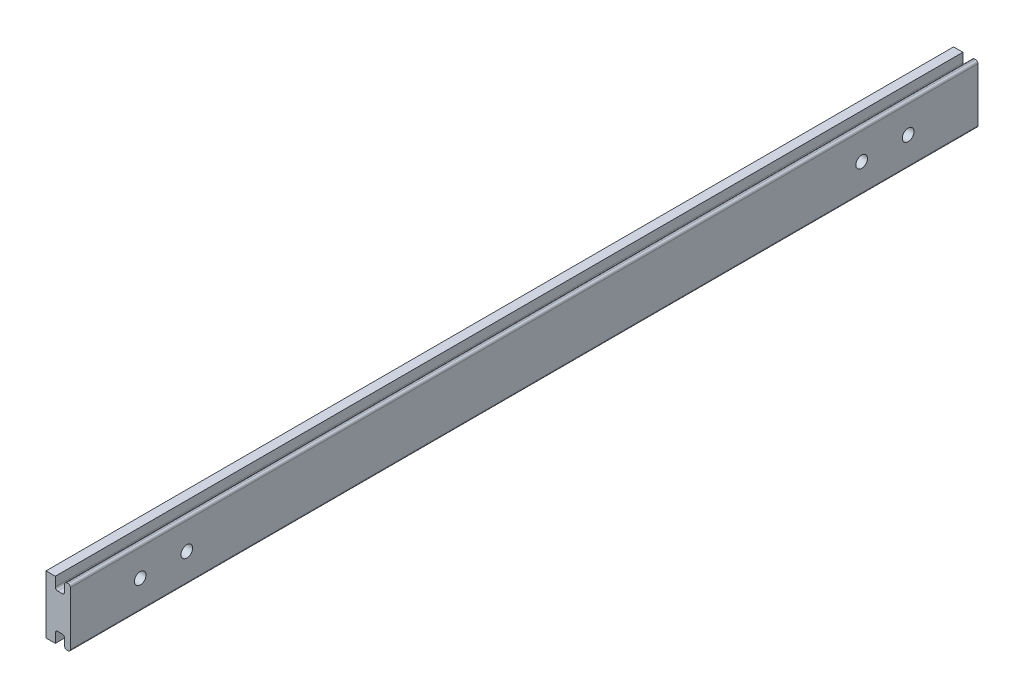
from build123d import *

# Parameters (mm, degrees)
BOSS_EXTRUDE1_DEPTH = 195
CUT_EXTRUDE1_REACH  = 197.682
SKETCH4_R           = 2.5
FILLET1_R           = 1


with BuildPart() as part:
    # Sketch3 → Boss-Extrude1 (new, symmetric)
    with BuildSketch(Plane.XY):
        with BuildLine():
            Line((-6, 12.5), (-6, -12.5))
            Line((-6, -12.5), (-2, -12.5))
            Line((-2, -12.5), (-2, -8.5))
            ThreePointArc((-2, -8.5), (-1.707106781, -7.792893219), (-1, -7.5))
            Line((-1, -7.5), (1, -7.5))
            ThreePointArc((1, -7.5), (1.707106781, -7.792893219), (2, -8.5))
            Line((2, -8.5), (2, -12.5))
            Line((2, -12.5), (4.5, -12.5))
            Line((4.5, -12.5), (4.5, 12.5))
            Line((4.5, 12.5), (2, 12.5))
            Line((2, 12.5), (2, 8.5))
            ThreePointArc((2, 8.5), (1.707106781, 7.792893219), (1, 7.5))
            Line((1, 7.5), (-1, 7.5))
            ThreePointArc((-1, 7.5), (-1.707106781, 7.792893219), (-2, 8.5))
            Line((-2, 8.5), (-2, 12.5))
            Line((-2, 12.5), (-6, 12.5))
        make_face()
    extrude(amount=BOSS_EXTRUDE1_DEPTH, both=True)

    # Sketch4 → Cut-Extrude1 (cut, up to next)
    with BuildSketch(Plane.ZY.offset(6), mode=Mode.PRIVATE) as cut_extrude1_sk1:
        with Locations((-165, 0)):
            Circle(SKETCH4_R)
    cut_extrude1_tool1 = extrude(cut_extrude1_sk1.sketch, amount=-CUT_EXTRUDE1_REACH, mode=Mode.PRIVATE) & part.part
    # Sketch4 → Cut-Extrude1 (cut, up to next)
    with BuildSketch(Plane.ZY.offset(6), mode=Mode.PRIVATE) as cut_extrude1_sk2:
        with Locations((-145, 0)):
            Circle(SKETCH4_R)
    cut_extrude1_tool2 = extrude(cut_extrude1_sk2.sketch, amount=-CUT_EXTRUDE1_REACH, mode=Mode.PRIVATE) & part.part
    # Sketch4 → Cut-Extrude1 (cut, up to next)
    with BuildSketch(Plane.ZY.offset(6), mode=Mode.PRIVATE) as cut_extrude1_sk3:
        with Locations((165, 0)):
            Circle(SKETCH4_R)
    cut_extrude1_tool3 = extrude(cut_extrude1_sk3.sketch, amount=-CUT_EXTRUDE1_REACH, mode=Mode.PRIVATE) & part.part
    # Sketch4 → Cut-Extrude1 (cut, up to next)
    with BuildSketch(Plane.ZY.offset(6), mode=Mode.PRIVATE) as cut_extrude1_sk4:
        with Locations((145, 0)):
            Circle(SKETCH4_R)
    cut_extrude1_tool4 = extrude(cut_extrude1_sk4.sketch, amount=-CUT_EXTRUDE1_REACH, mode=Mode.PRIVATE) & part.part
    add(cut_extrude1_tool1.solids().sort_by_distance((-6, 0, -165))[0], mode=Mode.SUBTRACT)
    add(cut_extrude1_tool2.solids().sort_by_distance((-6, 0, -145))[0], mode=Mode.SUBTRACT)
    add(cut_extrude1_tool3.solids().sort_by_distance((-6, 0, 165))[0], mode=Mode.SUBTRACT)
    add(cut_extrude1_tool4.solids().sort_by_distance((-6, 0, 145))[0], mode=Mode.SUBTRACT)

    # Fillet1
    fillet1_edges = [part.edges().sort_by_distance(p)[0] for p in [
        (2, 12.5, 0),
        (4.5, 12.5, 0),
        (4.5, -12.5, 0),
        (2, -12.5, 0),
    ]]
    fillet(fillet1_edges, radius=FILLET1_R)


solid = part.part
